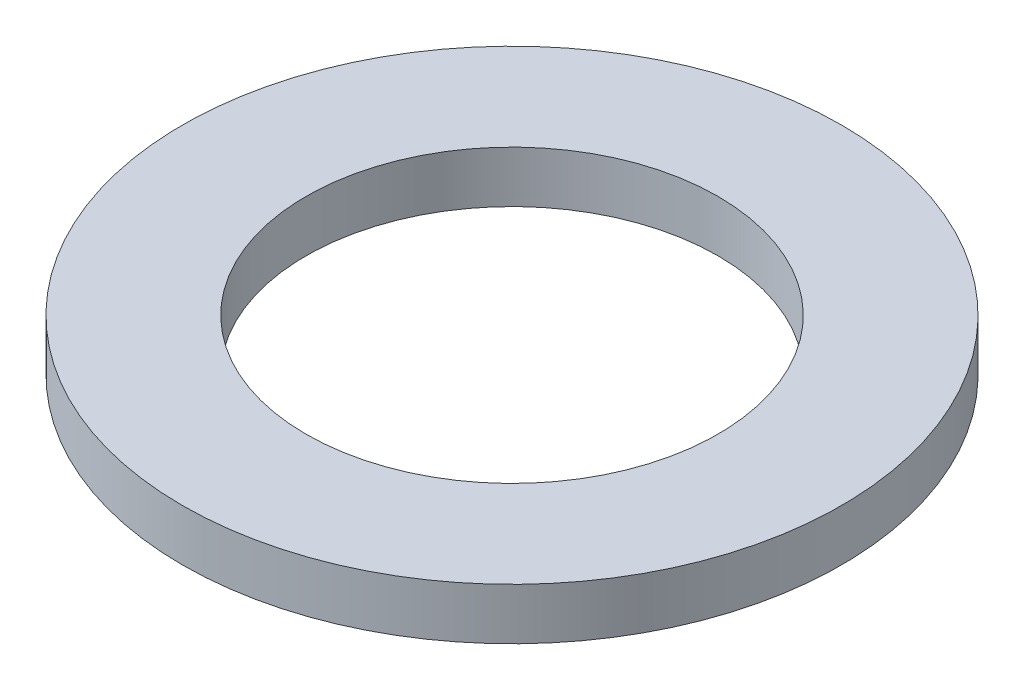
from build123d import *

# Parameters (mm, degrees)
SKETCH1_R           = 16
SKETCH1_W           = 2
SKETCH1_H           = 3
SKETCH1_R_2         = 10
BOSS_EXTRUDE3_DEPTH = 1
SKETCH2_R           = 16
SKETCH2_R_2         = 10
BOSS_EXTRUDE4_DEPTH = 1.5


with BuildPart() as part:
    # Sketch1 → Boss-Extrude3 (new body)
    with BuildSketch(Plane(origin=(0, 0, 0), x_dir=(1, 0, 0), z_dir=(0, 1, 0))):
        with Locations(Location((0, 0, 0), (0, 0, 270))):
            Circle(SKETCH1_R)
        Polygon((3.992867118, 13.97522852), (3.369132045, 11.040785718), (1.412836844, 11.456609099), (2.036571916, 14.391051901), align=None, mode=Mode.SUBTRACT)
        with Locations((0, 13)):
            Rectangle(SKETCH1_W, SKETCH1_H, mode=Mode.SUBTRACT)
        Polygon((6.811226782, 12.839672493), (5.591016853, 10.09903612), (3.763925938, 10.912509406), (4.984135867, 13.653145779), align=None, mode=Mode.SUBTRACT)
        Polygon((-2.036571916, 14.391051901), (-1.412836844, 11.456609099), (-3.369132045, 11.040785718), (-3.992867118, 13.97522852), align=None, mode=Mode.SUBTRACT)
        Polygon((9.331903153, 11.142961166), (7.568547396, 8.715910183), (5.950513407, 9.891480688), (7.713869164, 12.318531671), align=None, mode=Mode.SUBTRACT)
        Polygon((-4.984135867, 13.653145779), (-3.763925938, 10.912509406), (-5.591016853, 10.09903612), (-6.811226782, 12.839672493), align=None, mode=Mode.SUBTRACT)
        Polygon((-9.331903153, -11.142961166), (-7.568547396, -8.715910183), (-5.950513407, -9.891480688), (-7.713869164, -12.318531671), align=None, mode=Mode.SUBTRACT)
        Polygon((-11.444730576, -8.959248967), (-9.215296099, -6.951857148), (-7.877034887, -8.438146799), (-10.106469363, -10.445538618), align=None, mode=Mode.SUBTRACT)
        Polygon((-6.811226782, -12.839672493), (-5.591016853, -10.09903612), (-3.763925938, -10.912509406), (-4.984135867, -13.653145779), align=None, mode=Mode.SUBTRACT)
        with Locations((0, -13)):
            Rectangle(SKETCH1_W, SKETCH1_H, mode=Mode.SUBTRACT)
        Polygon((-1.412836844, -11.456609099), (-2.036571916, -14.391051901), (-3.992867118, -13.97522852), (-3.369132045, -11.040785718), align=None, mode=Mode.SUBTRACT)
        Polygon((-13.057368355, -6.383974596), (-10.459292144, -4.883974596), (-9.459292144, -6.616025404), (-12.057368355, -8.116025404), align=None, mode=Mode.SUBTRACT)
        Polygon((-14.099336481, -3.529689902), (-11.246166932, -2.602638919), (-10.628132943, -4.504751952), (-13.481302492, -5.431802935), align=None, mode=Mode.SUBTRACT)
        Polygon((-14.525095946, -0.521140822), (-11.54153026, -0.207555432), (-11.332473333, -2.196599223), (-14.31603902, -2.510184613), align=None, mode=Mode.SUBTRACT)
        Polygon((2.036571916, -14.391051901), (1.412836844, -11.456609099), (3.369132045, -11.040785718), (3.992867118, -13.97522852), align=None, mode=Mode.SUBTRACT)
        Polygon((4.984135867, -13.653145779), (3.763925938, -10.912509406), (5.591016853, -10.09903612), (6.811226782, -12.839672493), align=None, mode=Mode.SUBTRACT)
        Polygon((7.713869164, -12.318531671), (5.950513407, -9.891480688), (7.568547396, -8.715910183), (9.331903153, -11.142961166), align=None, mode=Mode.SUBTRACT)
        Polygon((10.106469363, -10.445538618), (7.877034887, -8.438146799), (9.215296099, -6.951857148), (11.444730576, -8.959248967), align=None, mode=Mode.SUBTRACT)
        Polygon((12.057368355, -8.116025404), (9.459292144, -6.616025404), (10.459292144, -4.883974596), (13.057368355, -6.383974596), align=None, mode=Mode.SUBTRACT)
        Polygon((13.481302492, -5.431802935), (10.628132943, -4.504751952), (11.246166932, -2.602638919), (14.099336481, -3.529689902), align=None, mode=Mode.SUBTRACT)
        Polygon((14.31603902, -2.510184613), (11.332473333, -2.196599223), (11.54153026, -0.207555432), (14.525095946, -0.521140822), align=None, mode=Mode.SUBTRACT)
        Polygon((-14.31603902, 2.510184613), (-11.332473333, 2.196599223), (-11.54153026, 0.207555432), (-14.525095946, 0.521140822), align=None, mode=Mode.SUBTRACT)
        Polygon((-13.481302492, 5.431802935), (-10.628132943, 4.504751952), (-11.246166932, 2.602638919), (-14.099336481, 3.529689902), align=None, mode=Mode.SUBTRACT)
        with Locations(Location((0, 0, 0), (0, 0, 270))):
            Circle(SKETCH1_R_2, mode=Mode.SUBTRACT)
        Polygon((-12.057368355, 8.116025404), (-9.459292144, 6.616025404), (-10.459292144, 4.883974596), (-13.057368355, 6.383974596), align=None, mode=Mode.SUBTRACT)
        Polygon((-10.106469363, 10.445538618), (-7.877034887, 8.438146799), (-9.215296099, 6.951857148), (-11.444730576, 8.959248967), align=None, mode=Mode.SUBTRACT)
        Polygon((-7.713869164, 12.318531671), (-5.950513407, 9.891480688), (-7.568547396, 8.715910183), (-9.331903153, 11.142961166), align=None, mode=Mode.SUBTRACT)
        Polygon((14.525095946, 0.521140822), (11.54153026, 0.207555432), (11.332473333, 2.196599223), (14.31603902, 2.510184613), align=None, mode=Mode.SUBTRACT)
        Polygon((14.099336481, 3.529689902), (11.246166932, 2.602638919), (10.628132943, 4.504751952), (13.481302492, 5.431802935), align=None, mode=Mode.SUBTRACT)
        Polygon((7.877034887, 8.438146799), (10.106469363, 10.445538618), (11.444730576, 8.959248967), (9.215296099, 6.951857148), align=None, mode=Mode.SUBTRACT)
        Polygon((13.057368355, 6.383974596), (10.459292144, 4.883974596), (9.459292144, 6.616025404), (12.057368355, 8.116025404), align=None, mode=Mode.SUBTRACT)
    extrude(amount=BOSS_EXTRUDE3_DEPTH)

    # Sketch2 → Boss-Extrude4 (add)
    with BuildSketch(Plane(origin=(0, 1, 0), x_dir=(1, 0, 0), z_dir=(0, 1, 0))):
        with Locations(Location((0, 0, 0), (0, 0, 270))):
            Circle(SKETCH2_R)
        with Locations(Location((0, 0, 0), (0, 0, 270))):
            Circle(SKETCH2_R_2, mode=Mode.SUBTRACT)
    extrude(amount=BOSS_EXTRUDE4_DEPTH)


solid = part.part
